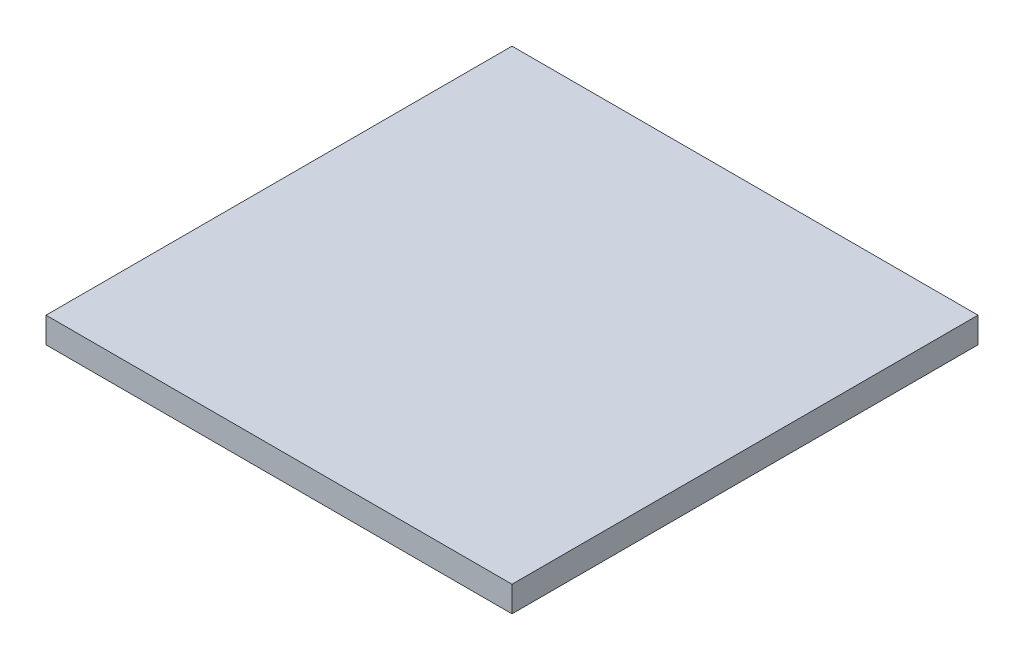
from build123d import *

# Parameters (mm, degrees)
SKETCH1_W           = 50.8
SKETCH1_H           = 50.8
BOSS_EXTRUDE1_DEPTH = 2.8


with BuildPart() as part:
    # Sketch1 → Boss-Extrude1 (new body)
    with BuildSketch(Plane(origin=(0, 0, 0), x_dir=(1, 0, 0), z_dir=(0, 1, 0))):
        Rectangle(SKETCH1_W, SKETCH1_H)
    extrude(amount=BOSS_EXTRUDE1_DEPTH)


solid = part.part
